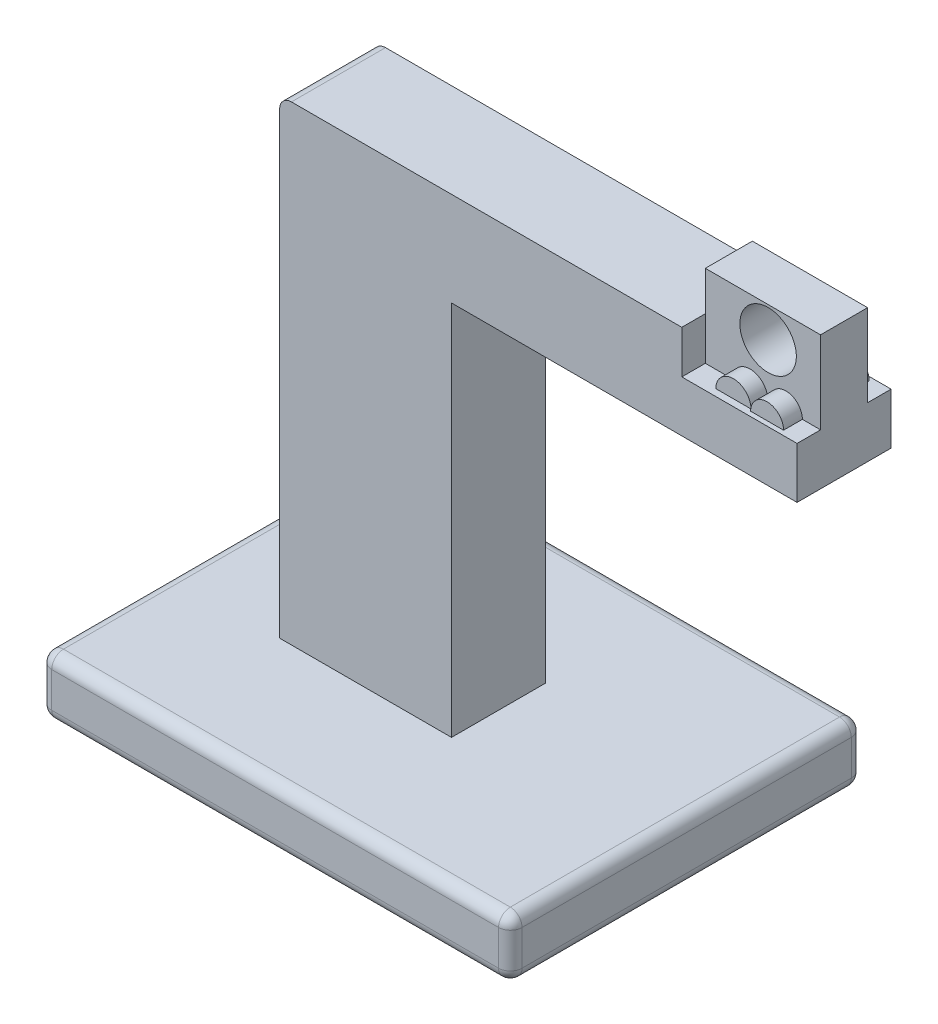
from build123d import *

# Parameters (mm, degrees)
SKETCH1_W                 = 508
SKETCH1_H                 = 381
BOSS_EXTRUDE1_DEPTH       = 63.5
FILLET4_R                 = 12.7
FILLET5_R                 = 12.7
FILLET6_R                 = 12.7
FILLET7_R                 = 12.7
FILLET8_R                 = 12.7
FILLET9_R                 = 12.7
SKETCH2_W                 = 185.582579438
SKETCH2_H                 = 101.6
BOSS_EXTRUDE2_DEPTH       = 406.4
SKETCH26_W                = 101.6
SKETCH26_H                = 101.6
BOSS_EXTRUDE16_DEPTH      = 558.8
SKETCH28_W                = 101.849960699
SKETCH28_H                = 50.8
CUT_EXTRUDE8_DEPTH        = 127
SKETCH29_W                = 124.46
SKETCH29_H                = 50.8
BOSS_EXTRUDE18_DEPTH      = 88.9
FILLET10_R                = 12.7
BOSS_EXTRUDE21_DEPTH      = 18.796
BOSS_EXTRUDE21_DEPTH_BACK = 73.66
SKETCH31_R                = 17.78
BOSS_EXTRUDE22_DEPTH      = 14.986
BOSS_EXTRUDE22_DEPTH_BACK = 71.374
SKETCH32_R                = 19.05
SKETCH33_R                = 30.48
CUT_EXTRUDE10_DEPTH       = 71.374
SCALE1_SCALE              = 1.5


with BuildPart() as part:
    # Sketch1 → Boss-Extrude1 (new body)
    with BuildSketch(Plane(origin=(0, 0, 0), x_dir=(1, 0, 0), z_dir=(0, 1, 0))):
        with Locations((254, 190.5)):
            Rectangle(SKETCH1_W, SKETCH1_H)
    extrude(amount=BOSS_EXTRUDE1_DEPTH)

    # Fillet4
    fillet4_edges = [part.edges().sort_by_distance(p)[0] for p in [
        (508, 31.75, 0),
    ]]
    fillet(fillet4_edges, radius=FILLET4_R)

    # Fillet5
    fillet5_edges = [part.edges().sort_by_distance(p)[0] for p in [
        (508, 31.75, -381),
    ]]
    fillet(fillet5_edges, radius=FILLET5_R)

    # Fillet6
    fillet6_edges = [part.edges().sort_by_distance(p)[0] for p in [
        (0, 31.75, -381),
    ]]
    fillet(fillet6_edges, radius=FILLET6_R)

    # Fillet7
    fillet7_edges = [part.edges().sort_by_distance(p)[0] for p in [
        (0, 31.75, 0),
    ]]
    fillet(fillet7_edges, radius=FILLET7_R)

    # Fillet8
    fillet8_edges = [part.edges().sort_by_distance(p)[0] for p in [
        (508, 0, -190.5),
        (504.280256121, 0, -3.719743879),
        (254, 0, -381),
        (504.280256121, 0, -377.280256121),
        (0, 0, -190.5),
        (3.719743879, 0, -377.280256121),
        (254, 0, 0),
        (3.719743879, 0, -3.719743879),
    ]]
    fillet(fillet8_edges, radius=FILLET8_R)

    # Fillet9
    fillet9_edges = [part.edges().sort_by_distance(p)[0] for p in [
        (508, 63.5, -190.5),
        (504.280256121, 63.5, -3.719743879),
        (254, 63.5, -381),
        (504.280256121, 63.5, -377.280256121),
        (0, 63.5, -190.5),
        (3.719743879, 63.5, -377.280256121),
        (254, 63.5, 0),
        (3.719743879, 63.5, -3.719743879),
    ]]
    fillet(fillet9_edges, radius=FILLET9_R)

    # Sketch2 → Boss-Extrude2 (add)
    with BuildSketch(Plane(origin=(0, 63.5, 0), x_dir=(1, 0, 0), z_dir=(0, 1, 0))):
        with Locations((212.008710281, 190.5)):
            Rectangle(SKETCH2_W, SKETCH2_H)
    extrude(amount=BOSS_EXTRUDE2_DEPTH)

    # Sketch26 → Boss-Extrude16 (add)
    with BuildSketch(Plane.ZY.offset(-119.217420562)):
        with Locations((-190.5, 520.7)):
            Rectangle(SKETCH26_W, SKETCH26_H)
    extrude(amount=-BOSS_EXTRUDE16_DEPTH)

    # Sketch28 → Cut-Extrude8 (cut)
    with BuildSketch(Plane(origin=(680.557420562, 0, 0), x_dir=(0, 0, -1), z_dir=(1, 0, 0))):
        with Locations((190.588941682, 550.48771611)):
            Rectangle(SKETCH28_W, SKETCH28_H)
    extrude(amount=-CUT_EXTRUDE8_DEPTH, mode=Mode.SUBTRACT)

    # Sketch29 → Boss-Extrude18 (add)
    with BuildSketch(Plane(origin=(0, 525.08771611, 0), x_dir=(1, 0, 0), z_dir=(0, 1, 0))):
        with Locations((615.787420562, 190.5)):
            Rectangle(SKETCH29_W, SKETCH29_H)
    extrude(amount=BOSS_EXTRUDE18_DEPTH)

    # Fillet10
    fillet10_edges = [part.edges().sort_by_distance(p)[0] for p in [
        (119.217420562, 571.5, -190.5),
    ]]
    fillet(fillet10_edges, radius=FILLET10_R)

    # Sketch31 → Boss-Extrude21 (add, two sides: drawn at the far end of the back side and taken through both)
    with BuildSketch(Plane(origin=(0, 0, -218.44), x_dir=(-1, 0, 0), z_dir=(0, 0, -1)).offset(-BOSS_EXTRUDE21_DEPTH_BACK)):
        with Locations((-640.580859251, 525.041927268)):
            Circle(SKETCH31_R)
    extrude(amount=BOSS_EXTRUDE21_DEPTH + BOSS_EXTRUDE21_DEPTH_BACK)

    # Sketch32 → Boss-Extrude22 (add, two sides: drawn at the far end of the back side and taken through both)
    with BuildSketch(Plane(origin=(0, 0, -218.44), x_dir=(-1, 0, 0), z_dir=(0, 0, -1)).offset(-BOSS_EXTRUDE22_DEPTH_BACK)):
        with Locations((-601.906085303, 524.903929641)):
            Circle(SKETCH32_R)
    extrude(amount=BOSS_EXTRUDE22_DEPTH + BOSS_EXTRUDE22_DEPTH_BACK)

    # Sketch33 → Cut-Extrude10 (cut)
    with BuildSketch(Plane(origin=(0, 0, -218.44), x_dir=(-1, 0, 0), z_dir=(0, 0, -1))):
        with Locations((-621.346482392, 580.790680071)):
            Circle(SKETCH33_R)
    extrude(amount=-CUT_EXTRUDE10_DEPTH, mode=Mode.SUBTRACT)


with BuildPart() as part_1:
    # Scale1: scaled about (272.242227358, 210.761068124, -190.500428021)
    add(part.part.scale(SCALE1_SCALE).moved(Location((-136.121113679, -105.380534062, 95.250214011))))


solid = part_1.part
